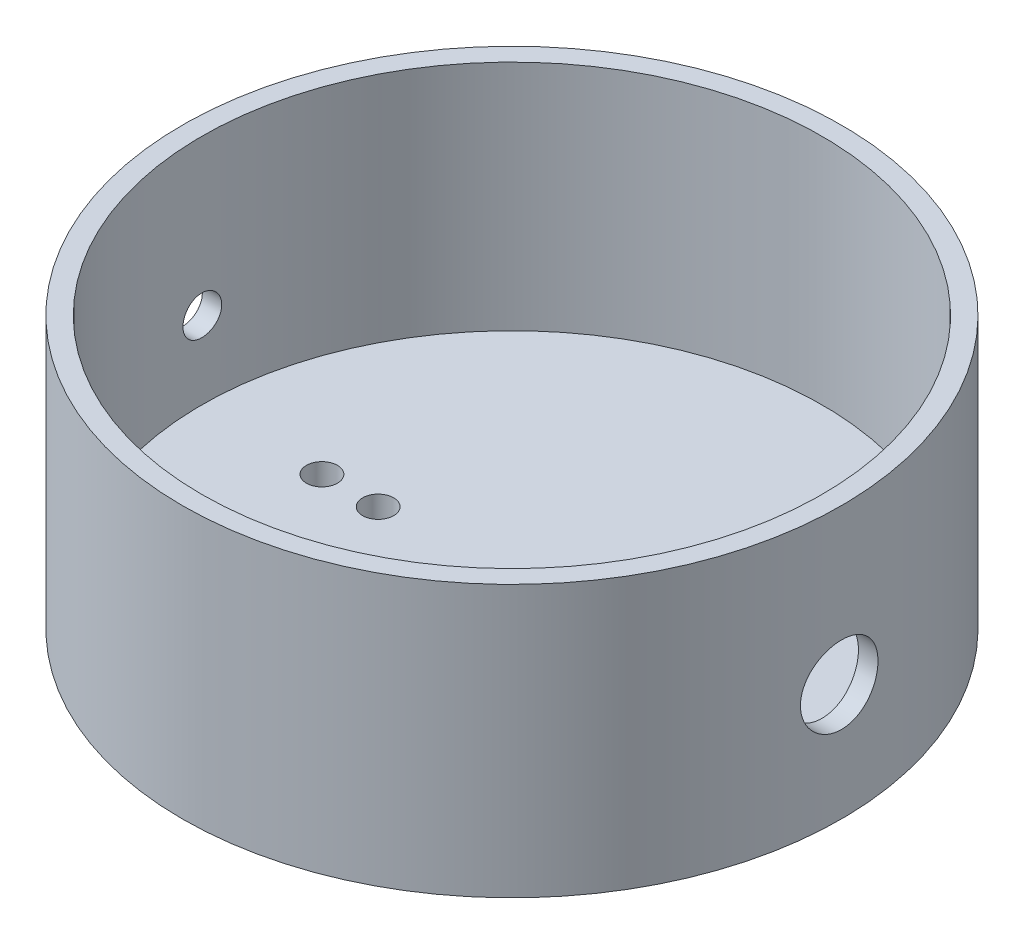
from build123d import *

# Parameters (mm, degrees)
SKETCH1_R               = 42.5
BOSS_EXTRUDE1_DEPTH     = 5
SKETCH2_R               = 42.5
SKETCH2_R_2             = 40
BOSS_EXTRUDE2_DEPTH     = 30
SKETCH3_R               = 2
BOSS_EXTRUDE3_DEPTH     = 5
CUT_EXTRUDE1_DEPTH      = 70.552138838
CUT_EXTRUDE1_DEPTH_BACK = 70.552138838
SKETCH3_3_R             = 2
CUT_EXTRUDE4_REACH      = 71.552
CUT_EXTRUDE4_END_RADIUS = 42.5
SKETCH4_R               = 2.5
SKETCH4_5_R             = 5
CUT_EXTRUDE8_DEPTH      = 50


with BuildPart() as part:
    # Sketch1 → Boss-Extrude1 (new body)
    with BuildSketch(Plane(origin=(0, 0, 0), x_dir=(1, 0, 0), z_dir=(0, 1, 0))):
        Circle(SKETCH1_R)
    extrude(amount=BOSS_EXTRUDE1_DEPTH)

    # Sketch2 → Boss-Extrude2 (add)
    with BuildSketch(Plane(origin=(0, 5, 0), x_dir=(1, 0, 0), z_dir=(0, 1, 0))):
        Circle(SKETCH2_R)
        Circle(SKETCH2_R_2, mode=Mode.SUBTRACT)
    extrude(amount=BOSS_EXTRUDE2_DEPTH)

    # Sketch3 → Boss-Extrude3 (add)
    with BuildSketch(Plane.XZ):
        with BuildLine():
            ThreePointArc((-25.178047354, -16.486591759), (-14.183962111, -19.037364236), (-7.815144583, -9.719933589))
            ThreePointArc((-7.815144583, -9.719933589), (-12.938182194, 0.241771609), (-7.410610084, 9.984822024))
            ThreePointArc((-7.410610084, 9.984822024), (-14.893502945, 19.290955178), (-25.95577439, 14.793850517))
            add(Edge.make_bspline(
                [(-25.95577439, 14.793850517), (-26.206471304, 14.310519768), (-26.451758672, 13.821089407), (-26.688052402, 13.325870914)],
                knots=[0, 0, 0, 0, 0.050650552, 0.050650552, 0.050650552, 0.050650552], degree=3))
            add(Edge.make_bspline(
                [(-26.688052402, 13.325870914), (-27.746594537, 11.107404767), (-28.624649084, 8.772780294), (-29, 6.35)],
                knots=[0.050650552, 0.050650552, 0.050650552, 0.050650552, 0.277553495, 0.277553495, 0.277553495, 0.277553495], degree=3))
            add(Edge.make_bspline(
                [(-29, 6.35), (-30.042272144, 0), (-29, -6.35)],
                knots=[0, 0, 0, 1, 1, 1], degree=2))
            add(Edge.make_bspline(
                [(-29, -6.35), (-28.699050384, -11.600454078), (-25.178047354, -16.486591759)],
                knots=[0.67268265, 0.67268265, 0.67268265, 1, 1, 1], degree=2))
        make_face()
        with Locations((-24.5, 0)):
            Circle(SKETCH3_R, mode=Mode.SUBTRACT)
        with Locations((-17.25, 0)):
            Circle(SKETCH3_R, mode=Mode.SUBTRACT)
    extrude(amount=BOSS_EXTRUDE3_DEPTH)

    # Sketch3<3> → Cut-Extrude1 (cut, two sides: drawn at the far end of the back side and taken through both)
    with BuildSketch(Plane.XZ.offset(-CUT_EXTRUDE1_DEPTH_BACK)):
        with Locations((-24.5, 0)):
            Circle(SKETCH3_3_R)
        with Locations((-17.25, 0)):
            Circle(SKETCH3_3_R)
    extrude(amount=CUT_EXTRUDE1_DEPTH + CUT_EXTRUDE1_DEPTH_BACK, mode=Mode.SUBTRACT)

    # Cut-Extrude4: up to this cylinder (the profile starts inside it)
    cut_extrude4_end = Plane(origin=(0, 15, 0), z_dir=(0, -1, 0)) * Cylinder(CUT_EXTRUDE4_END_RADIUS, 229.104, mode=Mode.PRIVATE)
    # Sketch4 → Cut-Extrude4 (cut, up to the surface)
    with BuildSketch(Plane(origin=(0, 0, 0), x_dir=(0, 0, -1), z_dir=(1, 0, 0)), mode=Mode.PRIVATE) as cut_extrude4_sk1:
        with Locations((0, 15)):
            Circle(SKETCH4_R)
    cut_extrude4_tool1 = extrude(cut_extrude4_sk1.sketch, amount=-CUT_EXTRUDE4_REACH, mode=Mode.PRIVATE) & cut_extrude4_end
    add(cut_extrude4_tool1.solids().sort_by_distance((0, 15, 0))[0], mode=Mode.SUBTRACT)

    # Sketch4<5> → Cut-Extrude8 (cut)
    with BuildSketch(Plane(origin=(0, 0, 0), x_dir=(0, 0, -1), z_dir=(1, 0, 0))):
        with Locations((0, 15)):
            Circle(SKETCH4_5_R)
    extrude(amount=CUT_EXTRUDE8_DEPTH, mode=Mode.SUBTRACT)


solid = part.part
